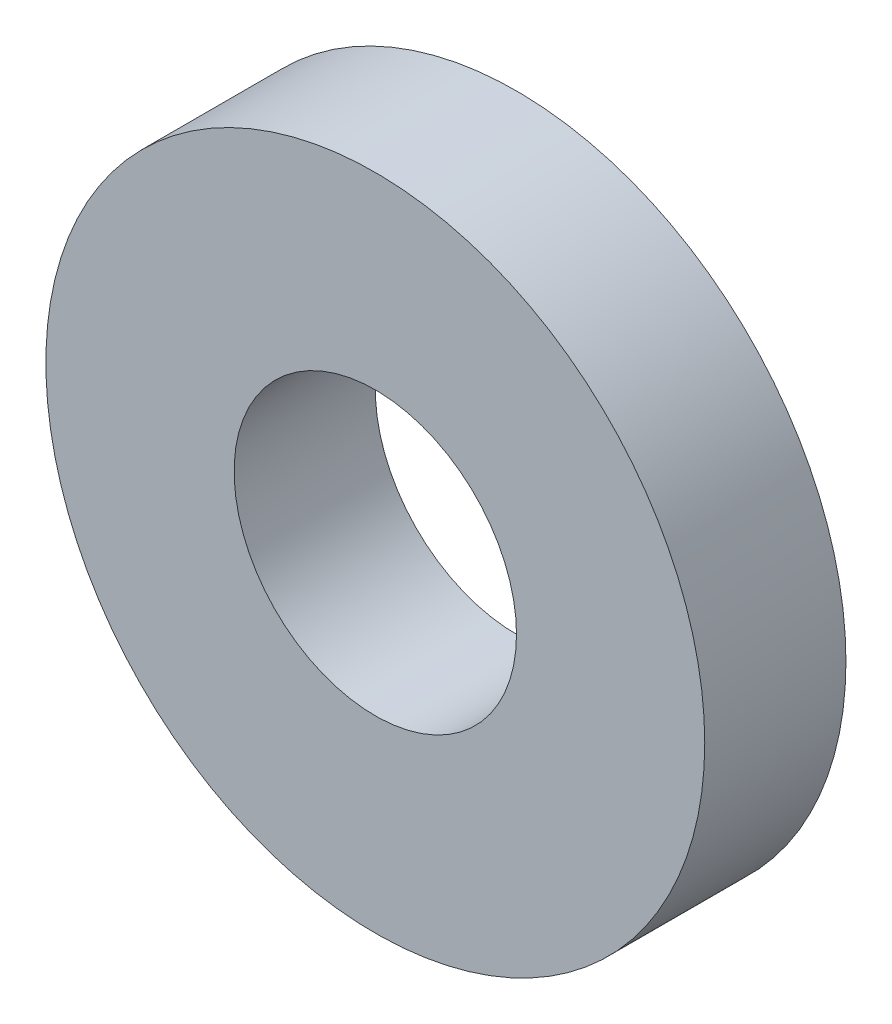
from build123d import *

# Parameters (mm, degrees)
ESQUISSE1_R        = 7
ESQUISSE1_R_2      = 3
BOSS_EXTRU_1_DEPTH = 3


with BuildPart() as part:
    # Esquisse1 → Boss.-Extru.1 (new body)
    with BuildSketch(Plane.XY):
        Circle(ESQUISSE1_R)
        Circle(ESQUISSE1_R_2, mode=Mode.SUBTRACT)
    extrude(amount=BOSS_EXTRU_1_DEPTH)


solid = part.part
